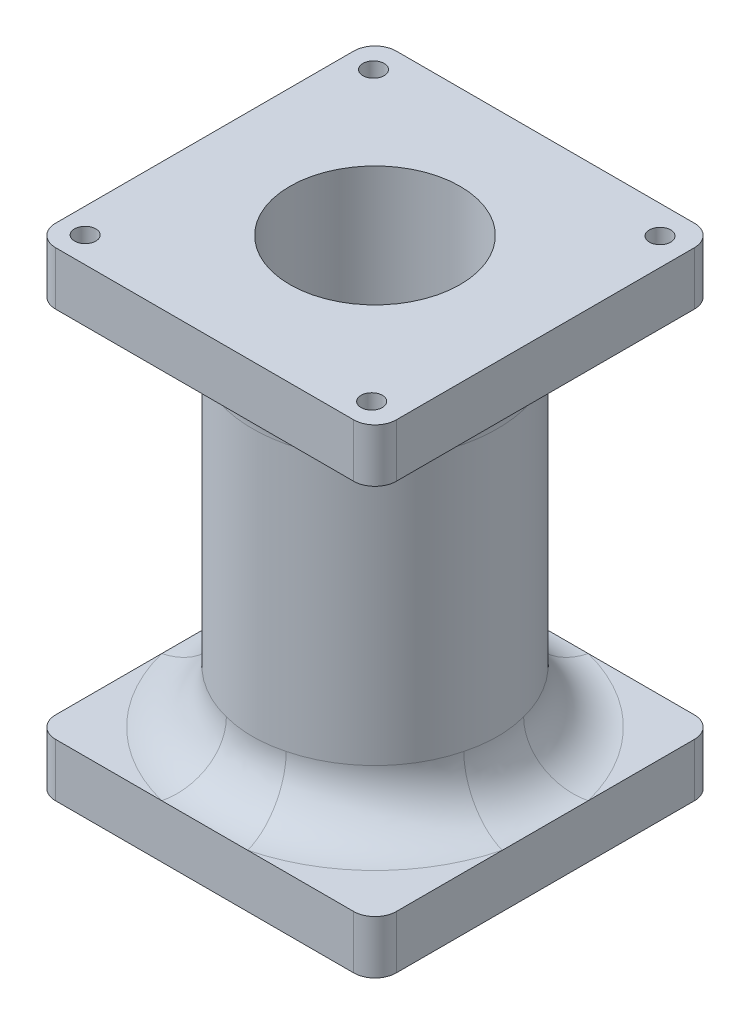
from build123d import *

# Parameters (mm, degrees)
BOSS_EXTRUDE1_DEPTH = 5
SKETCH2_R           = 11.5
BOSS_EXTRUDE2_DEPTH = 35
BOSS_EXTRUDE3_DEPTH = 5
SKETCH4_R           = 0.75
CUT_EXTRUDE1_DEPTH  = 3
CUT_EXTRUDE2_REACH  = 47.957
SKETCH5_R           = 1
CHAMFER1_SIZE       = 1
CUT_EXTRUDE3_REACH  = 52.369
SKETCH6_R           = 8
FILLET2_R           = 5


with BuildPart() as part:
    # Sketch1 → Boss-Extrude1 (new body)
    with BuildSketch(Plane(origin=(0, 0, 0), x_dir=(1, 0, 0), z_dir=(0, 1, 0))):
        with BuildLine():
            Line((-14, 16), (14, 16))
            ThreePointArc((14, 16), (15.414213562, 15.414213562), (16, 14))
            Line((16, 14), (16, -14))
            ThreePointArc((16, -14), (15.414213562, -15.414213562), (14, -16))
            Line((14, -16), (-14, -16))
            ThreePointArc((-14, -16), (-15.414213562, -15.414213562), (-16, -14))
            Line((-16, -14), (-16, 14))
            ThreePointArc((-16, 14), (-15.414213562, 15.414213562), (-14, 16))
        make_face()
    extrude(amount=BOSS_EXTRUDE1_DEPTH)

    # Sketch2 → Boss-Extrude2 (add)
    with BuildSketch(Plane(origin=(0, 5, 0), x_dir=(1, 0, 0), z_dir=(0, 1, 0))):
        with Locations(Location((0, 0, 0), (0, 0, 270))):
            Circle(SKETCH2_R)
    extrude(amount=BOSS_EXTRUDE2_DEPTH)

    # Sketch3 → Boss-Extrude3 (add)
    with BuildSketch(Plane(origin=(0, 40, 0), x_dir=(1, 0, 0), z_dir=(0, 1, 0))):
        with BuildLine():
            Line((-14, 16), (14, 16))
            ThreePointArc((14, 16), (15.414213562, 15.414213562), (16, 14))
            Line((16, 14), (16, -14))
            ThreePointArc((16, -14), (15.414213562, -15.414213562), (14, -16))
            Line((14, -16), (-14, -16))
            ThreePointArc((-14, -16), (-15.414213562, -15.414213562), (-16, -14))
            Line((-16, -14), (-16, 14))
            ThreePointArc((-16, 14), (-15.414213562, 15.414213562), (-14, 16))
        make_face()
    extrude(amount=BOSS_EXTRUDE3_DEPTH)

    # Sketch4 → Cut-Extrude1 (cut)
    with BuildSketch(Plane.XZ):
        with Locations(Location((-13.651323601, 13.573265233, 0), (0, 0, 270))):
            Circle(SKETCH4_R)
        with Locations(Location((13.348541156, 13.658723546, 0), (0, 0, 270))):
            Circle(SKETCH4_R)
        with Locations(Location((13.43399947, -13.34114121, 0), (0, 0, 270))):
            Circle(SKETCH4_R)
        with Locations(Location((-13.565865287, -13.426599524, 0), (0, 0, 270))):
            Circle(SKETCH4_R)
    extrude(amount=-CUT_EXTRUDE1_DEPTH, mode=Mode.SUBTRACT)

    # Sketch5 → Cut-Extrude2 (cut, up to next)
    with BuildSketch(Plane.XZ.offset(-40), mode=Mode.PRIVATE) as cut_extrude2_sk1:
        with Locations(Location((-13.651323601, 13.573265233, 0), (0, 0, 270))):
            Circle(SKETCH5_R)
    cut_extrude2_tool1 = extrude(cut_extrude2_sk1.sketch, amount=-CUT_EXTRUDE2_REACH, mode=Mode.PRIVATE) & part.part
    # Sketch5 → Cut-Extrude2 (cut, up to next)
    with BuildSketch(Plane.XZ.offset(-40), mode=Mode.PRIVATE) as cut_extrude2_sk2:
        with Locations(Location((13.348541156, 13.658723546, 0), (0, 0, 270))):
            Circle(SKETCH5_R)
    cut_extrude2_tool2 = extrude(cut_extrude2_sk2.sketch, amount=-CUT_EXTRUDE2_REACH, mode=Mode.PRIVATE) & part.part
    # Sketch5 → Cut-Extrude2 (cut, up to next)
    with BuildSketch(Plane.XZ.offset(-40), mode=Mode.PRIVATE) as cut_extrude2_sk3:
        with Locations(Location((-13.565865287, -13.426599524, 0), (0, 0, 270))):
            Circle(SKETCH5_R)
    cut_extrude2_tool3 = extrude(cut_extrude2_sk3.sketch, amount=-CUT_EXTRUDE2_REACH, mode=Mode.PRIVATE) & part.part
    # Sketch5 → Cut-Extrude2 (cut, up to next)
    with BuildSketch(Plane.XZ.offset(-40), mode=Mode.PRIVATE) as cut_extrude2_sk4:
        with Locations(Location((13.43399947, -13.34114121, 0), (0, 0, 270))):
            Circle(SKETCH5_R)
    cut_extrude2_tool4 = extrude(cut_extrude2_sk4.sketch, amount=-CUT_EXTRUDE2_REACH, mode=Mode.PRIVATE) & part.part
    add(cut_extrude2_tool1.solids().sort_by_distance((-13.651324, 40, 13.573265))[0], mode=Mode.SUBTRACT)
    add(cut_extrude2_tool2.solids().sort_by_distance((13.348541, 40, 13.658724))[0], mode=Mode.SUBTRACT)
    add(cut_extrude2_tool3.solids().sort_by_distance((-13.565865, 40, -13.4266))[0], mode=Mode.SUBTRACT)
    add(cut_extrude2_tool4.solids().sort_by_distance((13.433999, 40, -13.341141))[0], mode=Mode.SUBTRACT)

    # Chamfer1
    chamfer1_edges = [part.edges().sort_by_distance(p)[0] for p in [
        (13.348541156, 40, 14.658723546),
        (-13.565865287, 40, -12.426599524),
        (13.43399947, 40, -12.34114121),
        (-13.651323601, 40, 14.573265233),
    ]]
    chamfer(chamfer1_edges, length=CHAMFER1_SIZE)

    # Sketch6 → Cut-Extrude3 (cut, up to next)
    with BuildSketch(Plane.XZ, mode=Mode.PRIVATE) as cut_extrude3_sk1:
        with Locations(Location((0, 0, 0), (0, 0, 270))):
            Circle(SKETCH6_R)
    cut_extrude3_tool1 = extrude(cut_extrude3_sk1.sketch, amount=-CUT_EXTRUDE3_REACH, mode=Mode.PRIVATE) & part.part
    add(cut_extrude3_tool1.solids().sort_by_distance((0, 0, 0))[0], mode=Mode.SUBTRACT)

    # Fillet2
    fillet2_edges = [part.edges().sort_by_distance(p)[0] for p in [
        (0, 5, -11.5),
        (0, 40, -11.5),
    ]]
    fillet(fillet2_edges, radius=FILLET2_R)


solid = part.part
